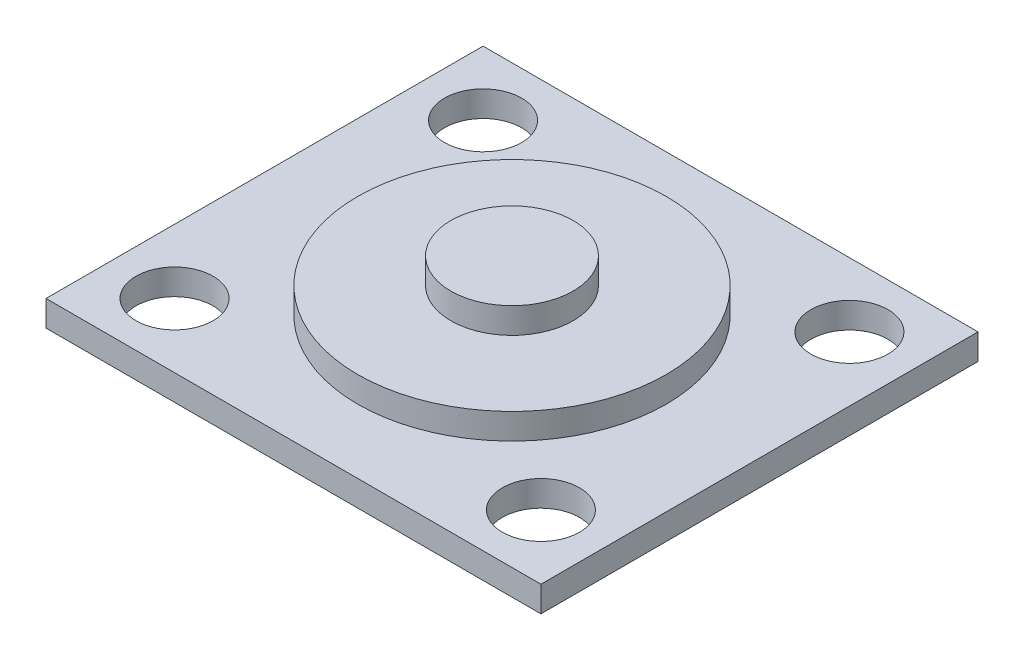
from build123d import *

# Parameters (mm, degrees)
SKETCH_3_W      = 38.5
SKETCH_3_H      = 34
SKETCH_3_R      = 3
EXTRUDE_1_DEPTH = 2
SKETCH_4_R      = 12
EXTRUDE_3_DEPTH = 4
SKETCH_6_R      = 4.758056851
EXTRUDE_4_DEPTH = 6


with BuildPart() as part:
    # 草图3 → 凸台-拉伸1 (new body)
    with BuildSketch(Plane(origin=(0, 0, 0), x_dir=(1, 0, 0), z_dir=(0, 1, 0))):
        with Locations((-10.049882631, -25.638405163)):
            Rectangle(SKETCH_3_W, SKETCH_3_H)
        with Locations(Location((-24.299882631, -13.638405163, 0), (0, 0, 270))):
            Circle(SKETCH_3_R, mode=Mode.SUBTRACT)
        with Locations(Location((4.200117369, -13.638405163, 0), (0, 0, 270))):
            Circle(SKETCH_3_R, mode=Mode.SUBTRACT)
        with Locations(Location((-24.299882631, -37.638405163, 0), (0, 0, 270))):
            Circle(SKETCH_3_R, mode=Mode.SUBTRACT)
        with Locations(Location((4.200117369, -37.638405163, 0), (0, 0, 270))):
            Circle(SKETCH_3_R, mode=Mode.SUBTRACT)
    extrude(amount=EXTRUDE_1_DEPTH)

    # 草图4 → 凸台-拉伸3 (add)
    with BuildSketch(Plane(origin=(0, 0, 0), x_dir=(1, 0, 0), z_dir=(0, 1, 0))):
        with Locations(Location((-10.049882631, -25.638405163, 0), (0, 0, 270))):
            Circle(SKETCH_4_R)
    extrude(amount=EXTRUDE_3_DEPTH)

    # 草图6 → 凸台-拉伸4 (add)
    with BuildSketch(Plane(origin=(0, 0, 0), x_dir=(1, 0, 0), z_dir=(0, 1, 0))):
        with Locations(Location((-10.049882631, -25.638405163, 0), (0, 0, 270))):
            Circle(SKETCH_6_R)
    extrude(amount=EXTRUDE_4_DEPTH)


solid = part.part
